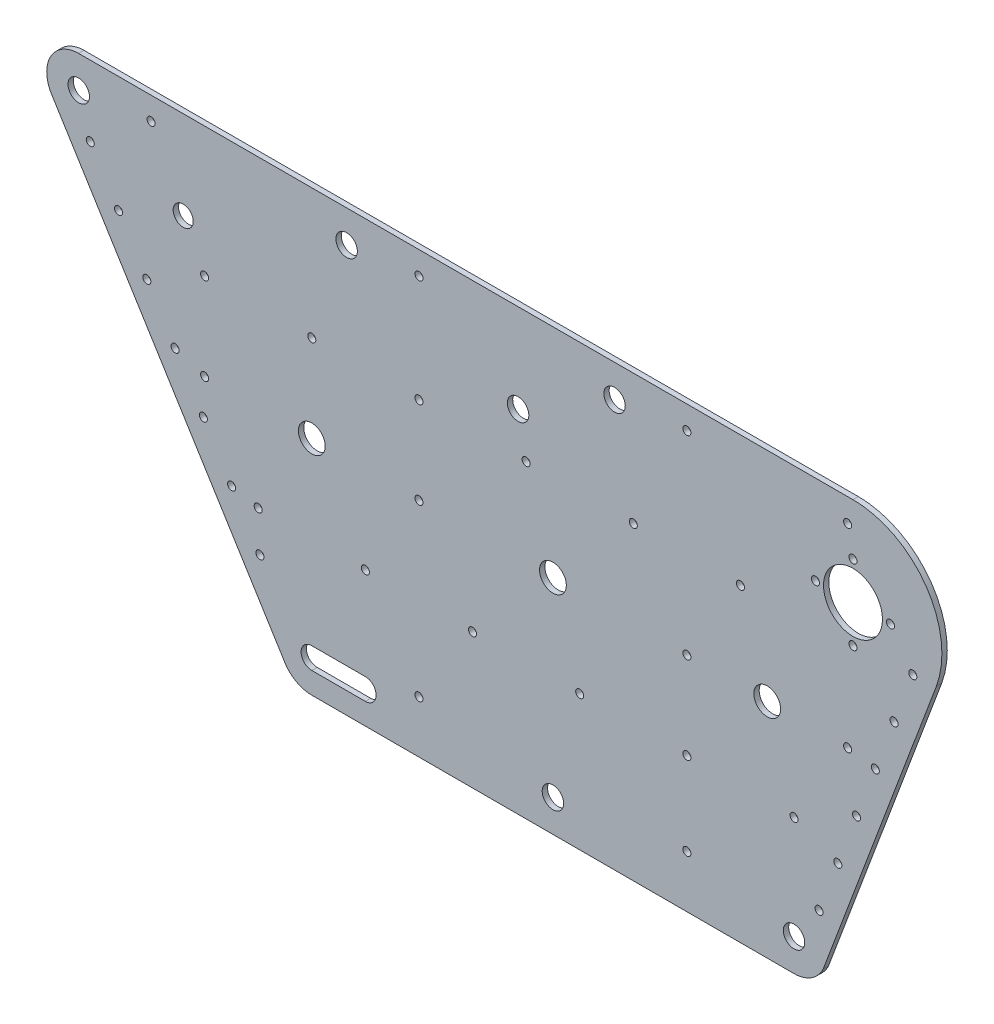
from build123d import *

# Parameters (mm, degrees)
BOSS_EXTRUDE4_DEPTH = 1


with BuildPart() as part:
    # Sketch6 → Boss-Extrude4 (new, symmetric)
    with BuildSketch(Plane.XY):
        with BuildLine():
            Line((182.961665791, 145.197671552), (-106.00519968, 144.943614194))
            add(Edge.make_bspline(
                [(-106.00519968, 144.943614194), (-127.679024036, 144.924558741), (-116.08546313, 126.611232779)],
                knots=[0.000879148, 0.000879148, 0.000879148, 2.135198153, 2.135198153, 2.135198153], degree=2, weights=[1, 0.482613975, 1]))
            Line((-116.08546313, 126.611232779), (-29.701931061, -12.425576557))
            add(Edge.make_bspline(
                [(-29.701931061, -12.425576557), (-26.369513305, -19.000000017), (-18.999049973, -19)],
                knots=[2.039949792, 2.039949792, 2.039949792, 3.141592656, 3.141592656, 3.141592656], degree=2, weights=[1, 0.852094883, 1]))
            Line((-18.999049973, -19), (160.991950179, -19))
            add(Edge.make_bspline(
                [(160.991950179, -19), (168.691832414, -18.999999885), (171.900116679, -12)],
                knots=[3.141592668, 3.141592668, 3.141592668, 4.282613549, 4.282613549, 4.282613549], degree=2, weights=[1, 0.841625416, 1]))
            Line((171.900116679, -12), (214.06903129, 100.332253713))
            add(Edge.make_bspline(
                [(214.06903129, 100.332253713), (230.926325183, 145.237792118), (182.96308424, 145.197672769)],
                knots=[4.353256006, 4.353256006, 4.353256006, 6.284014289, 6.284014289, 6.284014289], degree=2, weights=[1, 0.569095733, 0.999977608]))
            Line((182.96308424, 145.197672799), (182.961665791, 145.197671552))
        make_face()
        with BuildLine():
            add(Edge.make_bspline(
                [(-38.361920415, 18.171266638), (-40.959866722, 18.171266638), (-39.660893568, 15.921266638), (-38.361920415, 13.671266638), (-37.062947261, 15.921266638), (-35.763974107, 18.171266638), (-38.361920415, 18.171266638)],
                knots=[0, 0, 0, 2.094395102, 2.094395102, 4.188790205, 4.188790205, 6.283185307, 6.283185307, 6.283185307], degree=2, weights=[1, 0.5, 1, 0.5, 1, 0.5, 1]))
        make_face(mode=Mode.SUBTRACT)
        with BuildLine():
            add(Edge.make_bspline(
                [(-18.99905, -3), (-22.99885, -3), (-22.99885, -7), (-22.99885, -11), (-18.99905, -11)],
                knots=[3.141592654, 3.141592654, 3.141592654, 4.71238898, 4.71238898, 6.283185307, 6.283185307, 6.283185307], degree=2, weights=[1, 0.707106781, 1, 0.707106781, 1]))
            Line((-18.99905, -3), (0.99995, -3))
            add(Edge.make_bspline(
                [(0.99995, -11), (4.99975, -11), (4.99975, -7), (4.99975, -3), (0.99995, -3)],
                knots=[3.141592654, 3.141592654, 3.141592654, 4.71238898, 4.71238898, 6.283185307, 6.283185307, 6.283185307], degree=2, weights=[1, 0.707106781, 1, 0.707106781, 1]))
            Line((0.99995, -11), (-18.99905, -11))
        make_face(mode=Mode.SUBTRACT)
        with BuildLine():
            add(Edge.make_bspline(
                [(20.99895, 2), (18.401003692, 2), (19.699976846, -0.25), (20.99895, -2.5), (22.297923154, -0.25), (23.596896308, 2), (20.99895, 2)],
                knots=[0, 0, 0, 2.094395102, 2.094395102, 4.188790205, 4.188790205, 6.283185307, 6.283185307, 6.283185307], degree=2, weights=[1, 0.5, 1, 0.5, 1, 0.5, 1]))
        make_face(mode=Mode.SUBTRACT)
        with BuildLine():
            add(Edge.make_bspline(
                [(-38.99805, 32.999994311), (-41.595996308, 32.999994311), (-40.297023154, 30.749994311), (-38.99805, 28.499994311), (-37.699076846, 30.749994311), (-36.400103692, 32.999994311), (-38.99805, 32.999994311)],
                knots=[0, 0, 0, 2.094395102, 2.094395102, 4.188790205, 4.188790205, 6.283185307, 6.283185307, 6.283185307], degree=2, weights=[1, 0.5, 1, 0.5, 1, 0.5, 1]))
        make_face(mode=Mode.SUBTRACT)
        with BuildLine():
            add(Edge.make_bspline(
                [(-48.916261932, 35.158786529), (-51.51420824, 35.158786529), (-50.215235086, 32.908786529), (-48.916261932, 30.658786529), (-47.617288778, 32.908786529), (-46.318315625, 35.158786529), (-48.916261932, 35.158786529)],
                knots=[0, 0, 0, 2.094395102, 2.094395102, 4.188790205, 4.188790205, 6.283185307, 6.283185307, 6.283185307], degree=2, weights=[1, 0.5, 1, 0.5, 1, 0.5, 1]))
        make_face(mode=Mode.SUBTRACT)
        with BuildLine():
            add(Edge.make_bspline(
                [(-59.470762984, 52.146563195), (-62.068709292, 52.146563195), (-60.769736138, 49.896563195), (-59.470762984, 47.646563195), (-58.171789831, 49.896563195), (-56.872816677, 52.146563195), (-59.470762984, 52.146563195)],
                knots=[0, 0, 0, 2.094395102, 2.094395102, 4.188790205, 4.188790205, 6.283185307, 6.283185307, 6.283185307], degree=2, weights=[1, 0.5, 1, 0.5, 1, 0.5, 1]))
        make_face(mode=Mode.SUBTRACT)
        with BuildLine():
            add(Edge.make_bspline(
                [(0.99995, 32.999992415), (-1.597996308, 32.999992415), (-0.299023154, 30.749992415), (0.99995, 28.499992415), (2.298923154, 30.749992415), (3.597896308, 32.999992415), (0.99995, 32.999992415)],
                knots=[0, 0, 0, 2.094395102, 2.094395102, 4.188790205, 4.188790205, 6.283185307, 6.283185307, 6.283185307], degree=2, weights=[1, 0.5, 1, 0.5, 1, 0.5, 1]))
        make_face(mode=Mode.SUBTRACT)
        with BuildLine():
            add(Edge.make_bspline(
                [(40.99795, 32.999988622), (38.400003692, 32.999988622), (39.698976846, 30.749988622), (40.99795, 28.499988622), (42.296923154, 30.749988622), (43.595896308, 32.999988622), (40.99795, 32.999988622)],
                knots=[0, 0, 0, 2.094395102, 2.094395102, 4.188790205, 4.188790205, 6.283185307, 6.283185307, 6.283185307], degree=2, weights=[1, 0.5, 1, 0.5, 1, 0.5, 1]))
        make_face(mode=Mode.SUBTRACT)
        with BuildLine():
            add(Edge.make_bspline(
                [(70.99645, -3), (64.06859318, -3), (67.53252159, -9), (70.99645, -15), (74.46037841, -9), (77.92430682, -3), (70.99645, -3)],
                knots=[0, 0, 0, 2.094395102, 2.094395102, 4.188790205, 4.188790205, 6.283185307, 6.283185307, 6.283185307], degree=2, weights=[1, 0.5, 1, 0.5, 1, 0.5, 1]))
        make_face(mode=Mode.SUBTRACT)
        with BuildLine():
            add(Edge.make_bspline(
                [(120.99395, 2), (118.396003692, 2), (119.694976846, -0.25), (120.99395, -2.5), (122.292923154, -0.25), (123.591896308, 2), (120.99395, 2)],
                knots=[0, 0, 0, 2.094395102, 2.094395102, 4.188790205, 4.188790205, 6.283185307, 6.283185307, 6.283185307], degree=2, weights=[1, 0.5, 1, 0.5, 1, 0.5, 1]))
        make_face(mode=Mode.SUBTRACT)
        with BuildLine():
            add(Edge.make_bspline(
                [(160.99195, -3), (154.06409318, -3), (157.52802159, -9), (160.99195, -15), (164.45587841, -9), (167.91980682, -3), (160.99195, -3)],
                knots=[0, 0, 0, 2.094395102, 2.094395102, 4.188790205, 4.188790205, 6.283185307, 6.283185307, 6.283185307], degree=2, weights=[1, 0.5, 1, 0.5, 1, 0.5, 1]))
        make_face(mode=Mode.SUBTRACT)
        with BuildLine():
            add(Edge.make_bspline(
                [(170.332531489, 7.618627774), (167.734585182, 7.618627774), (169.033558335, 5.368627774), (170.332531489, 3.118627774), (171.631504643, 5.368627774), (172.930477797, 7.618627774), (170.332531489, 7.618627774)],
                knots=[0, 0, 0, 2.094395102, 2.094395102, 4.188790205, 4.188790205, 6.283185307, 6.283185307, 6.283185307], degree=2, weights=[1, 0.5, 1, 0.5, 1, 0.5, 1]))
        make_face(mode=Mode.SUBTRACT)
        with BuildLine():
            add(Edge.make_bspline(
                [(80.99595, 32.999985778), (78.398003692, 32.999985778), (79.696976846, 30.749985778), (80.99595, 28.499985778), (82.294923154, 30.749985778), (83.593896308, 32.999985778), (80.99595, 32.999985778)],
                knots=[0, 0, 0, 2.094395102, 2.094395102, 4.188790205, 4.188790205, 6.283185307, 6.283185307, 6.283185307], degree=2, weights=[1, 0.5, 1, 0.5, 1, 0.5, 1]))
        make_face(mode=Mode.SUBTRACT)
        with BuildLine():
            add(Edge.make_bspline(
                [(120.99395, 32.999981037), (118.396003692, 32.999981037), (119.694976846, 30.749981037), (120.99395, 28.499981037), (122.292923154, 30.749981037), (123.591896308, 32.999981037), (120.99395, 32.999981037)],
                knots=[0, 0, 0, 2.094395102, 2.094395102, 4.188790205, 4.188790205, 6.283185307, 6.283185307, 6.283185307], degree=2, weights=[1, 0.5, 1, 0.5, 1, 0.5, 1]))
        make_face(mode=Mode.SUBTRACT)
        with BuildLine():
            add(Edge.make_bspline(
                [(160.99195, 32.999978192), (158.394003692, 32.999978192), (159.692976846, 30.749978192), (160.99195, 28.499978192), (162.290923154, 30.749978192), (163.589896308, 32.999978192), (160.99195, 32.999978192)],
                knots=[0, 0, 0, 2.094395102, 2.094395102, 4.188790205, 4.188790205, 6.283185307, 6.283185307, 6.283185307], degree=2, weights=[1, 0.5, 1, 0.5, 1, 0.5, 1]))
        make_face(mode=Mode.SUBTRACT)
        with BuildLine():
            add(Edge.make_bspline(
                [(177.330672341, 26.354456596), (174.732726034, 26.354456596), (176.031699187, 24.104456596), (177.330672341, 21.854456596), (178.629645495, 24.104456596), (179.928618649, 26.354456596), (177.330672341, 26.354456596)],
                knots=[0, 0, 0, 2.094395102, 2.094395102, 4.188790205, 4.188790205, 6.283185307, 6.283185307, 6.283185307], degree=2, weights=[1, 0.5, 1, 0.5, 1, 0.5, 1]))
        make_face(mode=Mode.SUBTRACT)
        with BuildLine():
            add(Edge.make_bspline(
                [(184.328557385, 45.089600555), (181.730611078, 45.089600555), (183.029584232, 42.839600555), (184.328557385, 40.589600555), (185.627530539, 42.839600555), (186.926503693, 45.089600555), (184.328557385, 45.089600555)],
                knots=[0, 0, 0, 2.094395102, 2.094395102, 4.188790205, 4.188790205, 6.283185307, 6.283185307, 6.283185307], degree=2, weights=[1, 0.5, 1, 0.5, 1, 0.5, 1]))
        make_face(mode=Mode.SUBTRACT)
        with BuildLine():
            add(Edge.make_bspline(
                [(191.32646769, 63.824812144), (188.728521383, 63.824812144), (190.027494537, 61.574812144), (191.32646769, 59.324812144), (192.625440844, 61.574812144), (193.924413998, 63.824812144), (191.32646769, 63.824812144)],
                knots=[0, 0, 0, 2.094395102, 2.094395102, 4.188790205, 4.188790205, 6.283185307, 6.283185307, 6.283185307], degree=2, weights=[1, 0.5, 1, 0.5, 1, 0.5, 1]))
        make_face(mode=Mode.SUBTRACT)
        with BuildLine():
            add(Edge.make_bspline(
                [(-70.02547384, 69.134677545), (-72.623420147, 69.134677545), (-71.324446993, 66.884677545), (-70.02547384, 64.634677545), (-68.726500686, 66.884677545), (-67.427527532, 69.134677545), (-70.02547384, 69.134677545)],
                knots=[0, 0, 0, 2.094395102, 2.094395102, 4.188790205, 4.188790205, 6.283185307, 6.283185307, 6.283185307], degree=2, weights=[1, 0.5, 1, 0.5, 1, 0.5, 1]))
        make_face(mode=Mode.SUBTRACT)
        with BuildLine():
            add(Edge.make_bspline(
                [(-58.99705, 65.5), (-61.594996308, 65.5), (-60.296023154, 63.25), (-58.99705, 61), (-57.698076846, 63.25), (-56.399103692, 65.5), (-58.99705, 65.5)],
                knots=[0, 0, 0, 2.094395102, 2.094395102, 4.188790205, 4.188790205, 6.283185307, 6.283185307, 6.283185307], degree=2, weights=[1, 0.5, 1, 0.5, 1, 0.5, 1]))
        make_face(mode=Mode.SUBTRACT)
        with BuildLine():
            add(Edge.make_bspline(
                [(-91.134705429, 103.110600241), (-93.732651737, 103.110600241), (-92.433678583, 100.860600241), (-91.134705429, 98.610600241), (-89.835732276, 100.860600241), (-88.536759122, 103.110600241), (-91.134705429, 103.110600241)],
                knots=[0, 0, 0, 2.094395102, 2.094395102, 4.188790205, 4.188790205, 6.283185307, 6.283185307, 6.283185307], degree=2, weights=[1, 0.5, 1, 0.5, 1, 0.5, 1]))
        make_face(mode=Mode.SUBTRACT)
        with BuildLine():
            add(Edge.make_bspline(
                [(-80.580283096, 86.122950275), (-83.178229403, 86.122950275), (-81.87925625, 83.872950275), (-80.580283096, 81.622950275), (-79.281309942, 83.872950275), (-77.982336788, 86.122950275), (-80.580283096, 86.122950275)],
                knots=[0, 0, 0, 2.094395102, 2.094395102, 4.188790205, 4.188790205, 6.283185307, 6.283185307, 6.283185307], degree=2, weights=[1, 0.5, 1, 0.5, 1, 0.5, 1]))
        make_face(mode=Mode.SUBTRACT)
        with BuildLine():
            add(Edge.make_bspline(
                [(-58.99705, 98), (-61.594996308, 98), (-60.296023154, 95.75), (-58.99705, 93.5), (-57.698076846, 95.75), (-56.399103692, 98), (-58.99705, 98)],
                knots=[0, 0, 0, 2.094395102, 2.094395102, 4.188790205, 4.188790205, 6.283185307, 6.283185307, 6.283185307], degree=2, weights=[1, 0.5, 1, 0.5, 1, 0.5, 1]))
        make_face(mode=Mode.SUBTRACT)
        with BuildLine():
            add(Edge.make_bspline(
                [(-18.99905, 69), (-27.658871025, 69), (-23.328960513, 61.5), (-18.99905, 54), (-14.669139487, 61.5), (-10.339228975, 69), (-18.99905, 69)],
                knots=[0, 0, 0, 2.094395102, 2.094395102, 4.188790205, 4.188790205, 6.283185307, 6.283185307, 6.283185307], degree=2, weights=[1, 0.5, 1, 0.5, 1, 0.5, 1]))
        make_face(mode=Mode.SUBTRACT)
        with BuildLine():
            add(Edge.make_bspline(
                [(20.99895, 65.5), (18.401003692, 65.5), (19.699976846, 63.25), (20.99895, 61), (22.297923154, 63.25), (23.596896308, 65.5), (20.99895, 65.5)],
                knots=[0, 0, 0, 2.094395102, 2.094395102, 4.188790205, 4.188790205, 6.283185307, 6.283185307, 6.283185307], degree=2, weights=[1, 0.5, 1, 0.5, 1, 0.5, 1]))
        make_face(mode=Mode.SUBTRACT)
        with BuildLine():
            add(Edge.make_bspline(
                [(-18.99905, 98), (-21.596996308, 98), (-20.298023154, 95.75), (-18.99905, 93.5), (-17.700076846, 95.75), (-16.401103692, 98), (-18.99905, 98)],
                knots=[0, 0, 0, 2.094395102, 2.094395102, 4.188790205, 4.188790205, 6.283185307, 6.283185307, 6.283185307], degree=2, weights=[1, 0.5, 1, 0.5, 1, 0.5, 1]))
        make_face(mode=Mode.SUBTRACT)
        with BuildLine():
            add(Edge.make_bspline(
                [(20.99895, 98), (18.401003692, 98), (19.699976846, 95.75), (20.99895, 93.5), (22.297923154, 95.75), (23.596896308, 98), (20.99895, 98)],
                knots=[0, 0, 0, 2.094395102, 2.094395102, 4.188790205, 4.188790205, 6.283185307, 6.283185307, 6.283185307], degree=2, weights=[1, 0.5, 1, 0.5, 1, 0.5, 1]))
        make_face(mode=Mode.SUBTRACT)
        with BuildLine():
            add(Edge.make_bspline(
                [(-101.689209002, 120.098380963), (-104.287155309, 120.098380963), (-102.988182156, 117.848380963), (-101.689209002, 115.598380963), (-100.390235848, 117.848380963), (-99.091262694, 120.098380963), (-101.689209002, 120.098380963)],
                knots=[0, 0, 0, 2.094395102, 2.094395102, 4.188790205, 4.188790205, 6.283185307, 6.283185307, 6.283185307], degree=2, weights=[1, 0.5, 1, 0.5, 1, 0.5, 1]))
        make_face(mode=Mode.SUBTRACT)
        with BuildLine():
            add(Edge.make_bspline(
                [(-66.99665, 115.75), (-73.491515769, 115.75), (-70.244082884, 110.125), (-66.99665, 104.5), (-63.749217116, 110.125), (-60.501784231, 115.75), (-66.99665, 115.75)],
                knots=[0, 0, 0, 2.094395102, 2.094395102, 4.188790205, 4.188790205, 6.283185307, 6.283185307, 6.283185307], degree=2, weights=[1, 0.5, 1, 0.5, 1, 0.5, 1]))
        make_face(mode=Mode.SUBTRACT)
        with BuildLine():
            add(Edge.make_bspline(
                [(-105.9947, 137), (-112.92255682, 137), (-109.45862841, 131), (-105.9947, 125), (-102.53077159, 131), (-99.06684318, 137), (-105.9947, 137)],
                knots=[0, 0, 0, 2.094395102, 2.094395102, 4.188790205, 4.188790205, 6.283185307, 6.283185307, 6.283185307], degree=2, weights=[1, 0.5, 1, 0.5, 1, 0.5, 1]))
        make_face(mode=Mode.SUBTRACT)
        with BuildLine():
            add(Edge.make_bspline(
                [(-78.996040132, 138), (-81.59398644, 138), (-80.295013286, 135.75), (-78.996040132, 133.5), (-77.697066978, 135.75), (-76.398093824, 138), (-78.996040132, 138)],
                knots=[0, 0, 0, 2.094395102, 2.094395102, 4.188790205, 4.188790205, 6.283185307, 6.283185307, 6.283185307], degree=2, weights=[1, 0.5, 1, 0.5, 1, 0.5, 1]))
        make_face(mode=Mode.SUBTRACT)
        with BuildLine():
            add(Edge.make_bspline(
                [(-5.9997, 137), (-12.92755682, 137), (-9.46362841, 131), (-5.9997, 125), (-2.53577159, 131), (0.92815682, 137), (-5.9997, 137)],
                knots=[0, 0, 0, 2.094395102, 2.094395102, 4.188790205, 4.188790205, 6.283185307, 6.283185307, 6.283185307], degree=2, weights=[1, 0.5, 1, 0.5, 1, 0.5, 1]))
        make_face(mode=Mode.SUBTRACT)
        with BuildLine():
            add(Edge.make_bspline(
                [(20.99895, 138), (18.401003692, 138), (19.699976846, 135.75), (20.99895, 133.5), (22.297923154, 135.75), (23.596896308, 138), (20.99895, 138)],
                knots=[0, 0, 0, 2.094395102, 2.094395102, 4.188790205, 4.188790205, 6.283185307, 6.283185307, 6.283185307], degree=2, weights=[1, 0.5, 1, 0.5, 1, 0.5, 1]))
        make_face(mode=Mode.SUBTRACT)
        with BuildLine():
            add(Edge.make_bspline(
                [(70.99645, 69), (62.336628975, 69), (66.666539487, 61.5), (70.99645, 54), (75.326360513, 61.5), (79.656271025, 69), (70.99645, 69)],
                knots=[0, 0, 0, 2.094395102, 2.094395102, 4.188790205, 4.188790205, 6.283185307, 6.283185307, 6.283185307], degree=2, weights=[1, 0.5, 1, 0.5, 1, 0.5, 1]))
        make_face(mode=Mode.SUBTRACT)
        with BuildLine():
            add(Edge.make_bspline(
                [(120.99395, 65.5), (118.396003692, 65.5), (119.694976846, 63.25), (120.99395, 61), (122.292923154, 63.25), (123.591896308, 65.5), (120.99395, 65.5)],
                knots=[0, 0, 0, 2.094395102, 2.094395102, 4.188790205, 4.188790205, 6.283185307, 6.283185307, 6.283185307], degree=2, weights=[1, 0.5, 1, 0.5, 1, 0.5, 1]))
        make_face(mode=Mode.SUBTRACT)
        with BuildLine():
            add(Edge.make_bspline(
                [(60.99695, 98), (58.399003692, 98), (59.697976846, 95.75), (60.99695, 93.5), (62.295923154, 95.75), (63.594896308, 98), (60.99695, 98)],
                knots=[0, 0, 0, 2.094395102, 2.094395102, 4.188790205, 4.188790205, 6.283185307, 6.283185307, 6.283185307], degree=2, weights=[1, 0.5, 1, 0.5, 1, 0.5, 1]))
        make_face(mode=Mode.SUBTRACT)
        with BuildLine():
            add(Edge.make_bspline(
                [(100.99495, 98), (98.397003692, 98), (99.695976846, 95.75), (100.99495, 93.5), (102.293923154, 95.75), (103.592896308, 98), (100.99495, 98)],
                knots=[0, 0, 0, 2.094395102, 2.094395102, 4.188790205, 4.188790205, 6.283185307, 6.283185307, 6.283185307], degree=2, weights=[1, 0.5, 1, 0.5, 1, 0.5, 1]))
        make_face(mode=Mode.SUBTRACT)
        with BuildLine():
            add(Edge.make_bspline(
                [(140.99295, 98), (138.395003692, 98), (139.693976846, 95.75), (140.99295, 93.5), (142.291923154, 95.75), (143.590896308, 98), (140.99295, 98)],
                knots=[0, 0, 0, 2.094395102, 2.094395102, 4.188790205, 4.188790205, 6.283185307, 6.283185307, 6.283185307], degree=2, weights=[1, 0.5, 1, 0.5, 1, 0.5, 1]))
        make_face(mode=Mode.SUBTRACT)
        with BuildLine():
            add(Edge.make_bspline(
                [(150.99245, 69), (142.332628975, 69), (146.662539487, 61.5), (150.99245, 54), (155.322360513, 61.5), (159.652271025, 69), (150.99245, 69)],
                knots=[0, 0, 0, 2.094395102, 2.094395102, 4.188790205, 4.188790205, 6.283185307, 6.283185307, 6.283185307], degree=2, weights=[1, 0.5, 1, 0.5, 1, 0.5, 1]))
        make_face(mode=Mode.SUBTRACT)
        with BuildLine():
            add(Edge.make_bspline(
                [(180.99095, 65.5), (178.393003692, 65.5), (179.691976846, 63.25), (180.99095, 61), (182.289923154, 63.25), (183.588896308, 65.5), (180.99095, 65.5)],
                knots=[0, 0, 0, 2.094395102, 2.094395102, 4.188790205, 4.188790205, 6.283185307, 6.283185307, 6.283185307], degree=2, weights=[1, 0.5, 1, 0.5, 1, 0.5, 1]))
        make_face(mode=Mode.SUBTRACT)
        with BuildLine():
            add(Edge.make_bspline(
                [(198.324441471, 82.560193672), (195.726495163, 82.560193672), (197.025468317, 80.310193672), (198.324441471, 78.060193672), (199.623414624, 80.310193672), (200.922387778, 82.560193672), (198.324441471, 82.560193672)],
                knots=[0, 0, 0, 2.094395102, 2.094395102, 4.188790205, 4.188790205, 6.283185307, 6.283185307, 6.283185307], degree=2, weights=[1, 0.5, 1, 0.5, 1, 0.5, 1]))
        make_face(mode=Mode.SUBTRACT)
        with BuildLine():
            add(Edge.make_bspline(
                [(182.99085, 99.5), (180.392903692, 99.5), (181.691876846, 97.25), (182.99085, 95), (184.289823154, 97.25), (185.588796308, 99.5), (182.99085, 99.5)],
                knots=[0, 0, 0, 2.094395102, 2.094395102, 4.188790205, 4.188790205, 6.283185307, 6.283185307, 6.283185307], degree=2, weights=[1, 0.5, 1, 0.5, 1, 0.5, 1]))
        make_face(mode=Mode.SUBTRACT)
        with BuildLine():
            add(Edge.make_bspline(
                [(205.322481122, 101.295751553), (202.724534814, 101.295751553), (204.023507968, 99.045751553), (205.322481122, 96.795751553), (206.621454275, 99.045751553), (207.920427429, 101.295751553), (205.322481122, 101.295751553)],
                knots=[0, 0, 0, 2.094395102, 2.094395102, 4.188790205, 4.188790205, 6.283185307, 6.283185307, 6.283185307], degree=2, weights=[1, 0.5, 1, 0.5, 1, 0.5, 1]))
        make_face(mode=Mode.SUBTRACT)
        with BuildLine():
            add(Edge.make_bspline(
                [(57.9971, 116), (51.06924318, 116), (54.53317159, 110), (57.9971, 104), (61.46102841, 110), (64.92495682, 116), (57.9971, 116)],
                knots=[0, 0, 0, 2.094395102, 2.094395102, 4.188790205, 4.188790205, 6.283185307, 6.283185307, 6.283185307], degree=2, weights=[1, 0.5, 1, 0.5, 1, 0.5, 1]))
        make_face(mode=Mode.SUBTRACT)
        with BuildLine():
            add(Edge.make_bspline(
                [(93.995220809, 137), (87.067363989, 137), (90.531292399, 131), (93.995220809, 125), (97.459149219, 131), (100.923077629, 137), (93.995220809, 137)],
                knots=[0, 0, 0, 2.094395102, 2.094395102, 4.188790205, 4.188790205, 6.283185307, 6.283185307, 6.283185307], degree=2, weights=[1, 0.5, 1, 0.5, 1, 0.5, 1]))
        make_face(mode=Mode.SUBTRACT)
        with BuildLine():
            add(Edge.make_bspline(
                [(120.99395, 138), (118.396003692, 138), (119.694976846, 135.75), (120.99395, 133.5), (122.292923154, 135.75), (123.591896308, 138), (120.99395, 138)],
                knots=[0, 0, 0, 2.094395102, 2.094395102, 4.188790205, 4.188790205, 6.283185307, 6.283185307, 6.283185307], degree=2, weights=[1, 0.5, 1, 0.5, 1, 0.5, 1]))
        make_face(mode=Mode.SUBTRACT)
        with BuildLine():
            add(Edge.make_bspline(
                [(168.99155, 113.5), (166.393603692, 113.5), (167.692576846, 111.25), (168.99155, 109), (170.290523154, 111.25), (171.589496308, 113.5), (168.99155, 113.5)],
                knots=[0, 0, 0, 2.094395102, 2.094395102, 4.188790205, 4.188790205, 6.283185307, 6.283185307, 6.283185307], degree=2, weights=[1, 0.5, 1, 0.5, 1, 0.5, 1]))
        make_face(mode=Mode.SUBTRACT)
        with BuildLine():
            add(Edge.make_bspline(
                [(182.99085, 123), (163.939243745, 123), (173.465046872, 106.5), (182.99085, 90), (192.516653128, 106.5), (202.042456255, 123), (182.99085, 123)],
                knots=[0, 0, 0, 2.094395102, 2.094395102, 4.188790205, 4.188790205, 6.283185307, 6.283185307, 6.283185307], degree=2, weights=[1, 0.5, 1, 0.5, 1, 0.5, 1]))
        make_face(mode=Mode.SUBTRACT)
        with BuildLine():
            add(Edge.make_bspline(
                [(196.99015, 113.5), (194.392203692, 113.5), (195.691176846, 111.25), (196.99015, 109), (198.289123154, 111.25), (199.588096308, 113.5), (196.99015, 113.5)],
                knots=[0, 0, 0, 2.094395102, 2.094395102, 4.188790205, 4.188790205, 6.283185307, 6.283185307, 6.283185307], degree=2, weights=[1, 0.5, 1, 0.5, 1, 0.5, 1]))
        make_face(mode=Mode.SUBTRACT)
        with BuildLine():
            add(Edge.make_bspline(
                [(182.99085, 127.5), (180.392903692, 127.5), (181.691876846, 125.25), (182.99085, 123), (184.289823154, 125.25), (185.588796308, 127.5), (182.99085, 127.5)],
                knots=[0, 0, 0, 2.094395102, 2.094395102, 4.188790205, 4.188790205, 6.283185307, 6.283185307, 6.283185307], degree=2, weights=[1, 0.5, 1, 0.5, 1, 0.5, 1]))
        make_face(mode=Mode.SUBTRACT)
        with BuildLine():
            add(Edge.make_bspline(
                [(180.99095, 138), (178.393003692, 138), (179.691976846, 135.75), (180.99095, 133.5), (182.289923154, 135.75), (183.588896308, 138), (180.99095, 138)],
                knots=[0, 0, 0, 2.094395102, 2.094395102, 4.188790205, 4.188790205, 6.283185307, 6.283185307, 6.283185307], degree=2, weights=[1, 0.5, 1, 0.5, 1, 0.5, 1]))
        make_face(mode=Mode.SUBTRACT)
    extrude(amount=BOSS_EXTRUDE4_DEPTH, both=True)


solid = part.part
